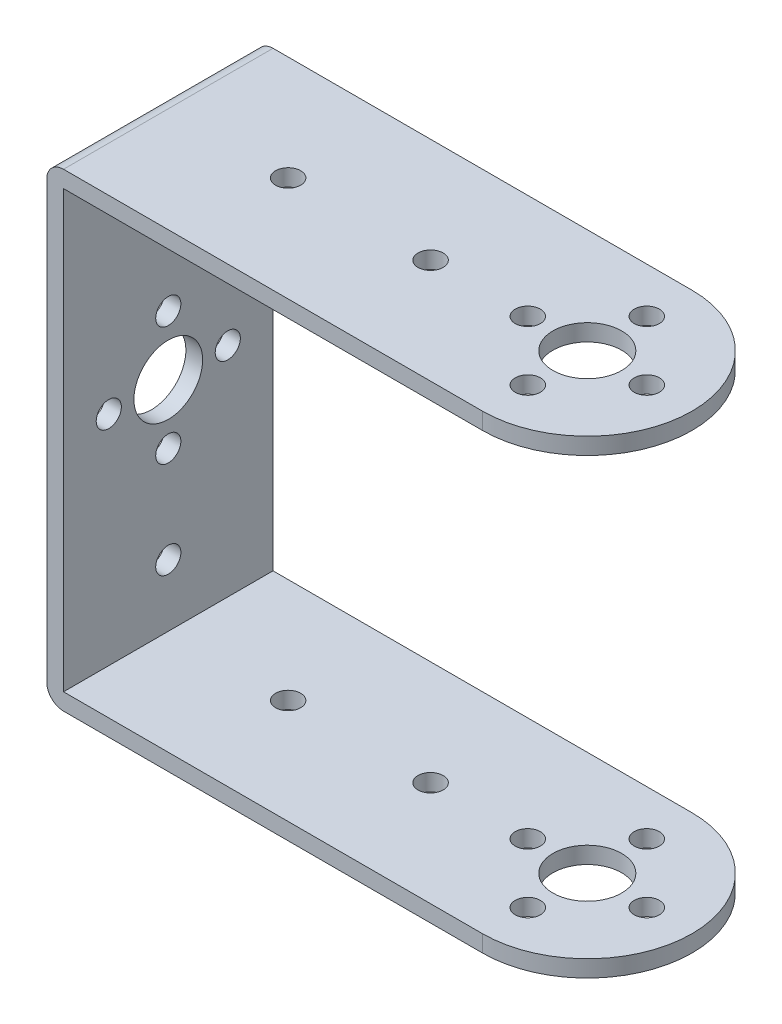
from build123d import *

# Parameters (mm, degrees)
SKETCH_1_W          = 44
SKETCH_1_H          = 25
EXTRUDE_1_DEPTH     = 2
FILLET_1_RADIUS     = 12.5
FILLET_1_LENGTH     = 2
CUT_EXTRUDE_2_REACH = 27.382
SKETCH_3_R          = 4.1
SKETCH_3_R_2        = 1.5
SKETCH_4_W          = 25
SKETCH_4_H          = 2
EXTRUDE_2_DEPTH     = 20.5
CUT_EXTRUDE_3_REACH = 46.345
SKETCH_5_R          = 1.5
SKETCH_6_W          = 2
SKETCH_6_H          = 25
EXTRUDE_3_DEPTH     = 56
CUT_EXTRUDE_4_REACH = 88.328
SKETCH_7_R          = 4.1
SKETCH_7_R_2        = 1.5
FILLET_2_R          = 2


with BuildPart() as part:
    # 草图1 → 凸台-拉伸1 (new body)
    with BuildSketch(Plane(origin=(0, 0, 0), x_dir=(1, 0, 0), z_dir=(0, 1, 0))):
        Rectangle(SKETCH_1_W, SKETCH_1_H)
    extrude(amount=-EXTRUDE_1_DEPTH)

    # 圆角1: full round fillet: the end face becomes a half cylinder, R = half its width
    fillet_1_face = Plane((22, -1, 0), x_dir=(0, 1, 0), z_dir=(1, 0, 0))  # on the end face: x along it, z out of the body
    fillet_1_slab = fillet_1_face.offset(-FILLET_1_RADIUS / 2) * Box(FILLET_1_LENGTH, 2 * FILLET_1_RADIUS, FILLET_1_RADIUS, mode=Mode.PRIVATE)  # the body's end, R deep
    fillet_1_round = Plane((9.5, -1, 0), x_dir=(1, 0, 0), z_dir=(0, 1, 0)) * Cylinder(FILLET_1_RADIUS, FILLET_1_LENGTH, mode=Mode.PRIVATE)  # its axis R under the face
    add(fillet_1_slab - fillet_1_round, mode=Mode.SUBTRACT)

    # 草图3 → 切除-拉伸2 (cut, up to next)
    with BuildSketch(Plane(origin=(0, 0, 0), x_dir=(1, 0, 0), z_dir=(0, 1, 0)), mode=Mode.PRIVATE) as cut_extrude_2_sk1:
        with Locations(Location((9.5, 0, 0), (0, 0, 270))):
            Circle(SKETCH_3_R)
    cut_extrude_2_tool1 = extrude(cut_extrude_2_sk1.sketch, amount=-CUT_EXTRUDE_2_REACH, mode=Mode.PRIVATE) & part.part
    # 草图3 → 切除-拉伸2 (cut, up to next)
    with BuildSketch(Plane(origin=(0, 0, 0), x_dir=(1, 0, 0), z_dir=(0, 1, 0)), mode=Mode.PRIVATE) as cut_extrude_2_sk2:
        with Locations(Location((2.4, 0, 0), (0, 0, 270))):
            Circle(SKETCH_3_R_2)
    cut_extrude_2_tool2 = extrude(cut_extrude_2_sk2.sketch, amount=-CUT_EXTRUDE_2_REACH, mode=Mode.PRIVATE) & part.part
    # 草图3 → 切除-拉伸2 (cut, up to next)
    with BuildSketch(Plane(origin=(0, 0, 0), x_dir=(1, 0, 0), z_dir=(0, 1, 0)), mode=Mode.PRIVATE) as cut_extrude_2_sk3:
        with Locations(Location((9.5, 7.1, 0), (0, 0, 270))):
            Circle(SKETCH_3_R_2)
    cut_extrude_2_tool3 = extrude(cut_extrude_2_sk3.sketch, amount=-CUT_EXTRUDE_2_REACH, mode=Mode.PRIVATE) & part.part
    # 草图3 → 切除-拉伸2 (cut, up to next)
    with BuildSketch(Plane(origin=(0, 0, 0), x_dir=(1, 0, 0), z_dir=(0, 1, 0)), mode=Mode.PRIVATE) as cut_extrude_2_sk4:
        with Locations(Location((16.6, 0, 0), (0, 0, 270))):
            Circle(SKETCH_3_R_2)
    cut_extrude_2_tool4 = extrude(cut_extrude_2_sk4.sketch, amount=-CUT_EXTRUDE_2_REACH, mode=Mode.PRIVATE) & part.part
    # 草图3 → 切除-拉伸2 (cut, up to next)
    with BuildSketch(Plane(origin=(0, 0, 0), x_dir=(1, 0, 0), z_dir=(0, 1, 0)), mode=Mode.PRIVATE) as cut_extrude_2_sk5:
        with Locations(Location((9.5, -7.1, 0), (0, 0, 270))):
            Circle(SKETCH_3_R_2)
    cut_extrude_2_tool5 = extrude(cut_extrude_2_sk5.sketch, amount=-CUT_EXTRUDE_2_REACH, mode=Mode.PRIVATE) & part.part
    # 草图3 → 切除-拉伸2 (cut, up to next)
    with BuildSketch(Plane(origin=(0, 0, 0), x_dir=(1, 0, 0), z_dir=(0, 1, 0)), mode=Mode.PRIVATE) as cut_extrude_2_sk6:
        with Locations(Location((-9.2, 0, 0), (0, 0, 270))):
            Circle(SKETCH_3_R_2)
    cut_extrude_2_tool6 = extrude(cut_extrude_2_sk6.sketch, amount=-CUT_EXTRUDE_2_REACH, mode=Mode.PRIVATE) & part.part
    add(cut_extrude_2_tool1.solids().sort_by_distance((9.5, 0, 0))[0], mode=Mode.SUBTRACT)
    add(cut_extrude_2_tool2.solids().sort_by_distance((2.4, 0, 0))[0], mode=Mode.SUBTRACT)
    add(cut_extrude_2_tool3.solids().sort_by_distance((9.5, 0, -7.1))[0], mode=Mode.SUBTRACT)
    add(cut_extrude_2_tool4.solids().sort_by_distance((16.6, 0, 0))[0], mode=Mode.SUBTRACT)
    add(cut_extrude_2_tool5.solids().sort_by_distance((9.5, 0, 7.1))[0], mode=Mode.SUBTRACT)
    add(cut_extrude_2_tool6.solids().sort_by_distance((-9.2, 0, 0))[0], mode=Mode.SUBTRACT)

    # 草图4 → 凸台-拉伸2 (add)
    with BuildSketch(Plane.ZY.offset(22)):
        with Locations((0, -1)):
            Rectangle(SKETCH_4_W, SKETCH_4_H)
    extrude(amount=EXTRUDE_2_DEPTH)

    # 草图5 → 切除-拉伸3 (cut, up to next)
    with BuildSketch(Plane(origin=(0, 0, 0), x_dir=(1, 0, 0), z_dir=(0, 1, 0)), mode=Mode.PRIVATE) as cut_extrude_3_sk1:
        with Locations(Location((-26.2, 0, 0), (0, 0, 270))):
            Circle(SKETCH_5_R)
    cut_extrude_3_tool1 = extrude(cut_extrude_3_sk1.sketch, amount=-CUT_EXTRUDE_3_REACH, mode=Mode.PRIVATE) & part.part
    add(cut_extrude_3_tool1.solids().sort_by_distance((-26.2, 0, 0))[0], mode=Mode.SUBTRACT)

    # 草图6 → 凸台-拉伸3 (add)
    with BuildSketch(Plane(origin=(0, 0, 0), x_dir=(1, 0, 0), z_dir=(0, 1, 0))):
        with Locations((-41.5, 0)):
            Rectangle(SKETCH_6_W, SKETCH_6_H)
    extrude(amount=-EXTRUDE_3_DEPTH)

    # 草图7 → 切除-拉伸4 (cut, up to next)
    with BuildSketch(Plane.ZY.offset(42.5), mode=Mode.PRIVATE) as cut_extrude_4_sk1:
        with Locations((0, -28)):
            Circle(SKETCH_7_R)
    cut_extrude_4_tool1 = extrude(cut_extrude_4_sk1.sketch, amount=-CUT_EXTRUDE_4_REACH, mode=Mode.PRIVATE) & part.part
    # 草图7 → 切除-拉伸4 (cut, up to next)
    with BuildSketch(Plane.ZY.offset(42.5), mode=Mode.PRIVATE) as cut_extrude_4_sk2:
        with Locations((-7.1, -28)):
            Circle(SKETCH_7_R_2)
    cut_extrude_4_tool2 = extrude(cut_extrude_4_sk2.sketch, amount=-CUT_EXTRUDE_4_REACH, mode=Mode.PRIVATE) & part.part
    # 草图7 → 切除-拉伸4 (cut, up to next)
    with BuildSketch(Plane.ZY.offset(42.5), mode=Mode.PRIVATE) as cut_extrude_4_sk3:
        with Locations((0, -20.9)):
            Circle(SKETCH_7_R_2)
    cut_extrude_4_tool3 = extrude(cut_extrude_4_sk3.sketch, amount=-CUT_EXTRUDE_4_REACH, mode=Mode.PRIVATE) & part.part
    # 草图7 → 切除-拉伸4 (cut, up to next)
    with BuildSketch(Plane.ZY.offset(42.5), mode=Mode.PRIVATE) as cut_extrude_4_sk4:
        with Locations((7.1, -28)):
            Circle(SKETCH_7_R_2)
    cut_extrude_4_tool4 = extrude(cut_extrude_4_sk4.sketch, amount=-CUT_EXTRUDE_4_REACH, mode=Mode.PRIVATE) & part.part
    # 草图7 → 切除-拉伸4 (cut, up to next)
    with BuildSketch(Plane.ZY.offset(42.5), mode=Mode.PRIVATE) as cut_extrude_4_sk5:
        with Locations((0, -35.1)):
            Circle(SKETCH_7_R_2)
    cut_extrude_4_tool5 = extrude(cut_extrude_4_sk5.sketch, amount=-CUT_EXTRUDE_4_REACH, mode=Mode.PRIVATE) & part.part
    # 草图7 → 切除-拉伸4 (cut, up to next)
    with BuildSketch(Plane.ZY.offset(42.5), mode=Mode.PRIVATE) as cut_extrude_4_sk6:
        with Locations((0, -9.4)):
            Circle(SKETCH_7_R_2)
    cut_extrude_4_tool6 = extrude(cut_extrude_4_sk6.sketch, amount=-CUT_EXTRUDE_4_REACH, mode=Mode.PRIVATE) & part.part
    # 草图7 → 切除-拉伸4 (cut, up to next)
    with BuildSketch(Plane.ZY.offset(42.5), mode=Mode.PRIVATE) as cut_extrude_4_sk7:
        with Locations(Location((0, -46.6, 0), (0, 0, 180))):
            Circle(SKETCH_7_R_2)
    cut_extrude_4_tool7 = extrude(cut_extrude_4_sk7.sketch, amount=-CUT_EXTRUDE_4_REACH, mode=Mode.PRIVATE) & part.part
    add(cut_extrude_4_tool1.solids().sort_by_distance((-42.5, -28, 0))[0], mode=Mode.SUBTRACT)
    add(cut_extrude_4_tool2.solids().sort_by_distance((-42.5, -28, -7.1))[0], mode=Mode.SUBTRACT)
    add(cut_extrude_4_tool3.solids().sort_by_distance((-42.5, -20.9, 0))[0], mode=Mode.SUBTRACT)
    add(cut_extrude_4_tool4.solids().sort_by_distance((-42.5, -28, 7.1))[0], mode=Mode.SUBTRACT)
    add(cut_extrude_4_tool5.solids().sort_by_distance((-42.5, -35.1, 0))[0], mode=Mode.SUBTRACT)
    add(cut_extrude_4_tool6.solids().sort_by_distance((-42.5, -9.4, 0))[0], mode=Mode.SUBTRACT)
    add(cut_extrude_4_tool7.solids().sort_by_distance((-42.5, -46.6, 0))[0], mode=Mode.SUBTRACT)

    # 镜向1: part across plane


with BuildPart() as part_1:
    add(part.part)
    add(part.part.mirror(Plane.ZX.offset(-28)))

    # 圆角2
    fillet_2_edges = [part_1.edges().sort_by_distance(p)[0] for p in [
        (-42.5, 0, 0),
        (-42.5, -56, 0),
    ]]
    fillet(fillet_2_edges, radius=FILLET_2_R)


solid = part_1.part
